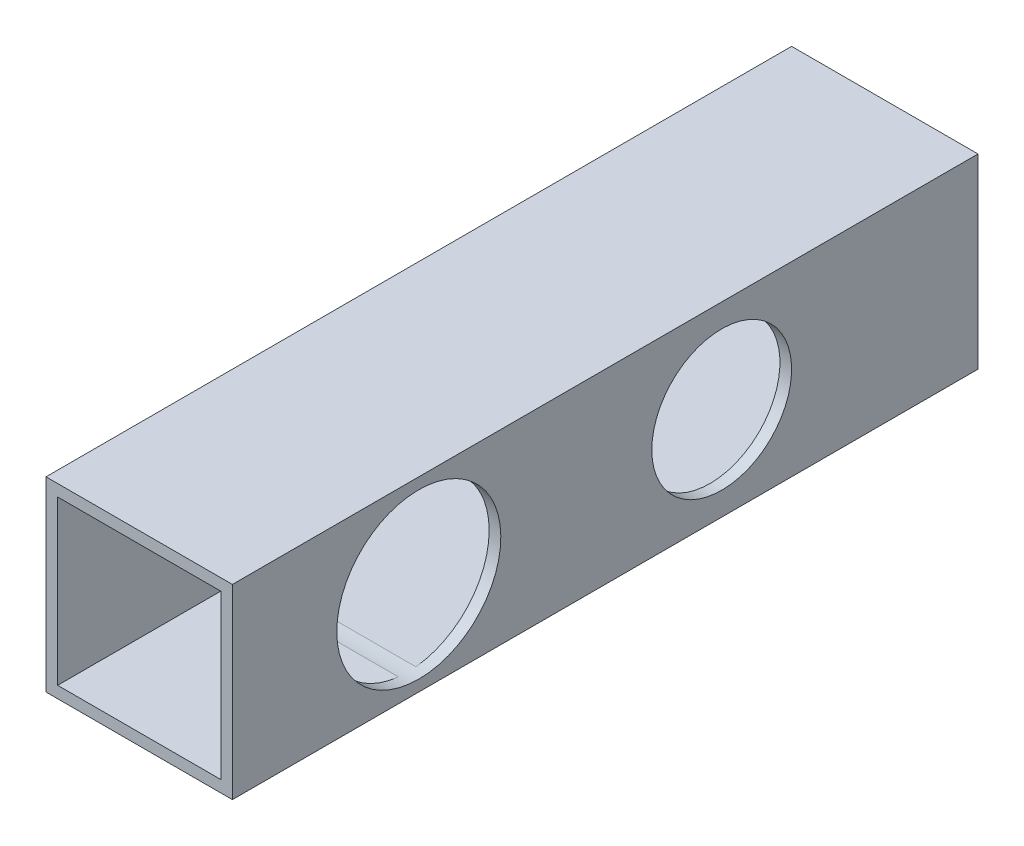
from build123d import *

# Parameters (mm, degrees)
BOSS_EXTRUDE1_DEPTH            = 914.4
BOSS_EXTRUDE1_DEPTH_BACK       = 914.4
SKETCH3_W                      = 25.4
SKETCH3_H                      = 25.4
SKETCH3_W_2                    = 22.225
SKETCH3_H_2                    = 22.225
SKETCH5_W                      = 58.75494954
SKETCH5_H                      = 44.648037504
CUT_EXTRUDE1_DEPTH             = 1727.2
CUT_EXTRUDE2_REACH             = 916.841
SKETCH6_R                      = 9.525
SKETCH6_R_2                    = 11.176
CUT_EXTRUDE2_DIRECTION_2_DEPTH = 915.840865943
CUT_EXTRUDE3_DEPTH             = 915.798166349
CUT_EXTRUDE3_DEPTH_BACK        = 915.798166349
SKETCH9_R                      = 3.175


with BuildPart() as part:
    # Sketch3 → Boss-Extrude1 (new, two sides: drawn at the far end of the back side and taken through both)
    with BuildSketch(Plane.XY.offset(-BOSS_EXTRUDE1_DEPTH_BACK)):
        Rectangle(SKETCH3_W, SKETCH3_H)
        Rectangle(SKETCH3_W_2, SKETCH3_H_2, mode=Mode.SUBTRACT)
    extrude(amount=BOSS_EXTRUDE1_DEPTH + BOSS_EXTRUDE1_DEPTH_BACK)

    # Sketch5 → Cut-Extrude1 (cut)
    with BuildSketch(Plane.XY.offset(914.4)):
        Rectangle(SKETCH5_W, SKETCH5_H)
    extrude(amount=-CUT_EXTRUDE1_DEPTH, mode=Mode.SUBTRACT)

    # Cut-Extrude2: up to this face of the body (flat: up to its plane)
    cut_extrude2_end = Plane(part.part.faces().sort_by_distance((-11.1125, 0, -863.6))[0])
    # Sketch6 → Cut-Extrude2 (cut, up to the picked face)
    with BuildSketch(Plane(origin=(12.7, 0, 0), x_dir=(0, 0, -1), z_dir=(1, 0, 0)), mode=Mode.PRIVATE) as cut_extrude2_sk1:
        with Locations(Location((879.475, 0, 0), (0, 0, 180))):
            Circle(SKETCH6_R)
    cut_extrude2_tool1 = split(extrude(cut_extrude2_sk1.sketch, amount=-CUT_EXTRUDE2_REACH, mode=Mode.PRIVATE), bisect_by=cut_extrude2_end, keep=Keep.BOTH, mode=Mode.PRIVATE)
    # Sketch6 → Cut-Extrude2 (cut, up to the picked face)
    with BuildSketch(Plane(origin=(12.7, 0, 0), x_dir=(0, 0, -1), z_dir=(1, 0, 0)), mode=Mode.PRIVATE) as cut_extrude2_sk2:
        with Locations(Location((838.2, 0, 0), (0, 0, 83.889353751))):
            Circle(SKETCH6_R_2)
    cut_extrude2_tool2 = split(extrude(cut_extrude2_sk2.sketch, amount=-CUT_EXTRUDE2_REACH, mode=Mode.PRIVATE), bisect_by=cut_extrude2_end, keep=Keep.BOTH, mode=Mode.PRIVATE)
    add(cut_extrude2_tool1.solids().sort_by(Axis((12.7, 0, -879.475), (-1, 0, 0)))[0], mode=Mode.SUBTRACT)
    add(cut_extrude2_tool2.solids().sort_by(Axis((12.7, 0, -838.2), (-1, 0, 0)))[0], mode=Mode.SUBTRACT)

    # Sketch6 → Cut-Extrude2 direction 2 (cut)
    with BuildSketch(Plane(origin=(12.7, 0, 0), x_dir=(0, 0, -1), z_dir=(1, 0, 0))):
        with Locations(Location((879.475, 0, 0), (0, 0, 180))):
            Circle(SKETCH6_R)
        with Locations(Location((838.2, 0, 0), (0, 0, 83.889353751))):
            Circle(SKETCH6_R_2)
    extrude(amount=CUT_EXTRUDE2_DIRECTION_2_DEPTH, mode=Mode.SUBTRACT)

    # Sketch9 → Cut-Extrude3 (cut, two sides: drawn at the far end of the back side and taken through both)
    with BuildSketch(Plane(origin=(-11.1125, 0, 0), x_dir=(0, 0, -1), z_dir=(1, 0, 0)).offset(-CUT_EXTRUDE3_DEPTH_BACK)):
        with Locations((879.475, 0)):
            Circle(SKETCH9_R)
    extrude(amount=CUT_EXTRUDE3_DEPTH + CUT_EXTRUDE3_DEPTH_BACK, mode=Mode.SUBTRACT)


solid = part.part
